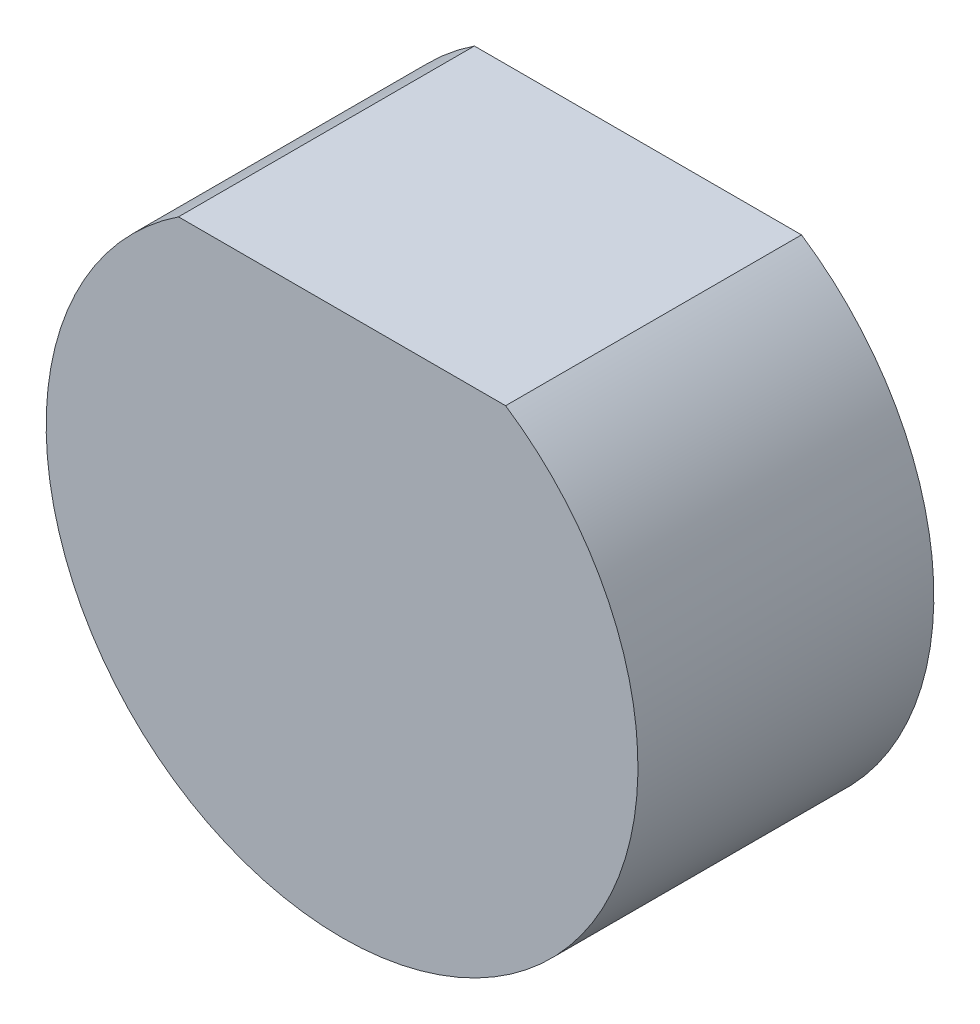
from build123d import *

# Parameters (mm, degrees)
BOSS_EXTRUDE1_DEPTH = 6


with BuildPart() as part:
    # Sketch1 → Boss-Extrude1 (new body)
    with BuildSketch(Plane.XY):
        with BuildLine():
            Line((-3.31662479, 5), (3.31662479, 5))
            ThreePointArc((3.31662479, 5), (0, -6), (-3.31662479, 5))
        make_face()
    extrude(amount=BOSS_EXTRUDE1_DEPTH)


solid = part.part
